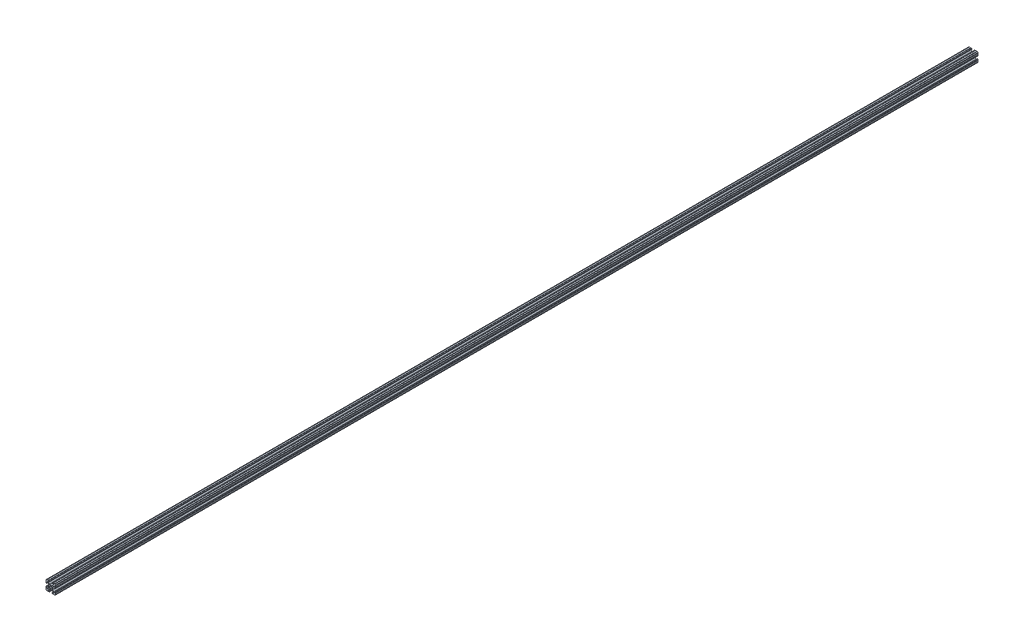
from build123d import *

# Parameters (mm, degrees)
BOSS_EXTRUDE1_DEPTH     = 1219.2
CUT_EXTRUDE1_DEPTH      = 1220.33228449
CUT_EXTRUDE1_DEPTH_BACK = 1220.33228449
SKETCH5_R               = 0.55245


with BuildPart() as part:
    # Sketch4 → Boss-Extrude1 (new, symmetric)
    with BuildSketch(Plane.XY):
        with BuildLine():
            Line((4.190365, -12.7), (10.11729625, -12.7))
            ThreePointArc((10.11729625, -12.7), (11.943543585, -11.943543585), (12.7, -10.11729625))
            Line((12.7, -10.11729625), (12.7, -4.190365))
            ThreePointArc((12.7, -4.190365), (12.42492494, -3.52627506), (11.760835, -3.2512))
            Line((11.760835, -3.2512), (11.429365, -3.2512))
            ThreePointArc((11.429365, -3.2512), (10.76527506, -3.52627506), (10.4902, -4.190365))
            Line((10.4902, -4.190365), (10.4902, -6.348478019))
            ThreePointArc((10.4902, -6.348478019), (9.830707141, -7.335478831), (8.666460301, -7.103895736))
            Line((8.666460301, -7.103895736), (5.299899128, -3.737334563))
            ThreePointArc((5.299899128, -3.737334563), (4.817571085, -3.015479634), (4.6482, -2.16399369))
            Line((4.6482, -2.16399369), (4.6482, 0))
            Line((4.6482, 0), (2.6035, 0))
            ThreePointArc((2.6035, 0), (1.840952505, -1.840952505), (0, -2.6035))
            Line((0, -2.6035), (0, -4.6482))
            Line((0, -4.6482), (2.16399369, -4.6482))
            ThreePointArc((2.16399369, -4.6482), (3.015479634, -4.817571085), (3.737334563, -5.299899128))
            Line((3.737334563, -5.299899128), (7.103895736, -8.666460301))
            ThreePointArc((7.103895736, -8.666460301), (7.335478831, -9.830707141), (6.348478019, -10.4902))
            Line((6.348478019, -10.4902), (4.190365, -10.4902))
            ThreePointArc((4.190365, -10.4902), (3.52627506, -10.76527506), (3.2512, -11.429365))
            Line((3.2512, -11.429365), (3.2512, -11.760835))
            ThreePointArc((3.2512, -11.760835), (3.52627506, -12.42492494), (4.190365, -12.7))
        make_face()
    extrude(amount=BOSS_EXTRUDE1_DEPTH, both=True)

    # Sketch5 → Cut-Extrude1 (cut, two sides: drawn at the far end of the back side and taken through both)
    with BuildSketch(Plane.XY.offset(-CUT_EXTRUDE1_DEPTH_BACK)):
        with Locations((10.356153152, -12.7)):
            Circle(SKETCH5_R)
        with Locations((5.796028019, -12.7)):
            Circle(SKETCH5_R)
        with Locations((12.7, -10.356153152)):
            Circle(SKETCH5_R)
        with Locations((12.7, -5.796028019)):
            Circle(SKETCH5_R)
    extrude(amount=CUT_EXTRUDE1_DEPTH + CUT_EXTRUDE1_DEPTH_BACK, mode=Mode.SUBTRACT)

    # Mirror1: part across plane


with BuildPart() as part_1:
    add(part.part)
    add(part.part.mirror(Plane(origin=(0, 0, 0), x_dir=(0, 0, 1), z_dir=(1, 0, 0))))

    # Mirror2: part across plane


with BuildPart() as part_2:
    add(part_1.part)
    add(part_1.part.mirror(Plane.ZX))


solid = part_2.part
